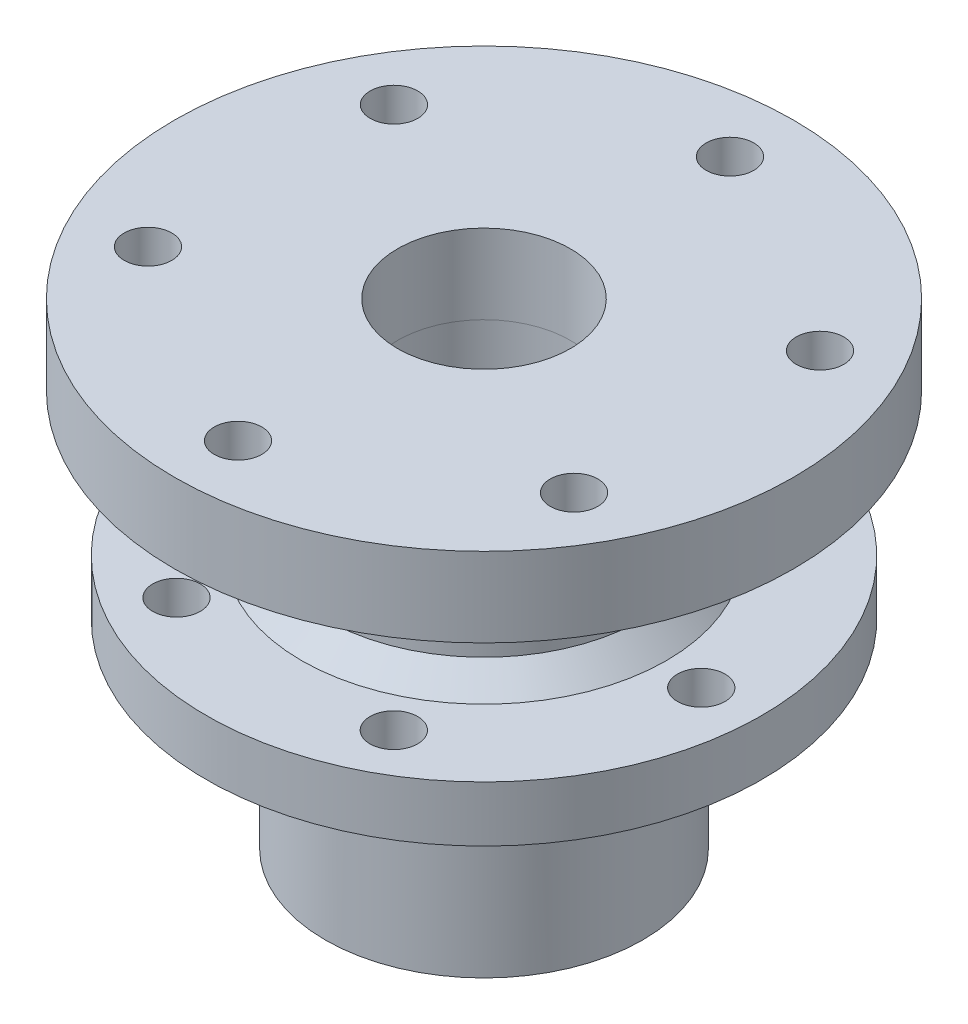
from build123d import *

# Parameters (mm, degrees)
EXTRUDE_START       = -10
SKETCH_1_R          = 20
SKETCH_1_R_2        = 11
EXTRUDE_1_DEPTH     = 50
SKETCH_2_R          = 39
SKETCH_2_R_2        = 10.9
EXTRUDE_2_DEPTH     = 10
CHAMFER_1_SIZE      = 4
SKETCH_3_R          = 35
SKETCH_3_R_2        = 17
EXTRUDE_3_DEPTH     = 7
CHAMFER_2_SIZE      = 3
SKETCH_4_R          = 3.000000009
CUT_EXTRUDE_1_DEPTH = 64.765194268
CUT_EXTRUDE_4_REACH = 83.498
SKETCH_5_R          = 3


with BuildPart() as part:
    # Эскиз1 → Вытянуть1 (new body)
    with BuildSketch(Plane(origin=(0, 0, 0), x_dir=(1, 0, 0), z_dir=(0, 1, 0)).offset(EXTRUDE_START)):
        with Locations(Location((0, 0, 0), (0, 0, 270))):
            Circle(SKETCH_1_R)
        with Locations(Location((0, 0, 0), (0, 0, 270))):
            Circle(SKETCH_1_R_2, mode=Mode.SUBTRACT)
    extrude(amount=EXTRUDE_1_DEPTH)

    # Эскиз2 → Вытянуть2 (add)
    with BuildSketch(Plane(origin=(0, 40, 0), x_dir=(1, 0, 0), z_dir=(0, 1, 0))):
        with Locations(Location((0, 0, 0), (0, 0, 270))):
            Circle(SKETCH_2_R)
        with Locations(Location((0, 0, 0), (0, 0, 270))):
            Circle(SKETCH_2_R_2, mode=Mode.SUBTRACT)
    extrude(amount=EXTRUDE_2_DEPTH)

    # Фаска1
    chamfer_1_edges = [part.edges().sort_by_distance(p)[0] for p in [
        (0, 40, -20),
    ]]
    chamfer(chamfer_1_edges, length=CHAMFER_1_SIZE)

    # Эскиз3 → Вытянуть3 (add)
    with BuildSketch(Plane.XZ.offset(-15)):
        with Locations(Location((0, 0, 0), (0, 0, 270))):
            Circle(SKETCH_3_R)
        Circle(SKETCH_3_R_2, mode=Mode.SUBTRACT)
    extrude(amount=-EXTRUDE_3_DEPTH)

    # Фаска2
    chamfer_2_edges = [part.edges().sort_by_distance(p)[0] for p in [
        (0, 22, -20),
    ]]
    chamfer(chamfer_2_edges, length=CHAMFER_2_SIZE)

    # Эскиз4 → Вырез-Вытянуть1 (cut, through all)
    with BuildSketch(Plane(origin=(0, 22, 0), x_dir=(1, 0, 0), z_dir=(0, 1, 0))):
        with Locations(Location((-13.413764566, 24.758384407, 0), (0, 0, 270))):
            Circle(SKETCH_4_R)
        with Locations(Location((14.742626006, 23.99086611, 0), (0, 0, 270))):
            Circle(SKETCH_4_R)
        with Locations(Location((28.156130949, -0.777042552, 0), (0, 0, 270))):
            Circle(SKETCH_4_R)
        with Locations(Location((13.41324532, -24.777432917, 0), (0, 0, 270))):
            Circle(SKETCH_4_R)
        with Locations(Location((-14.743145251, -24.009914621, 0), (0, 0, 270))):
            Circle(SKETCH_4_R)
        with Locations(Location((-28.156650194, 0.757994041, 0), (0, 0, 270))):
            Circle(SKETCH_4_R)
    extrude(amount=-CUT_EXTRUDE_1_DEPTH, mode=Mode.SUBTRACT)

    # Эскиз5 → Вытянуть4 (cut, up to next)
    with BuildSketch(Plane(origin=(0, 50, 0), x_dir=(1, 0, 0), z_dir=(0, 1, 0)), mode=Mode.PRIVATE) as cut_extrude_4_sk1:
        with Locations(Location((0, 31, 0), (0, 0, 270))):
            Circle(SKETCH_5_R)
    cut_extrude_4_tool1 = extrude(cut_extrude_4_sk1.sketch, amount=-CUT_EXTRUDE_4_REACH, mode=Mode.PRIVATE) & part.part
    # Эскиз5 → Вытянуть4 (cut, up to next)
    with BuildSketch(Plane(origin=(0, 50, 0), x_dir=(1, 0, 0), z_dir=(0, 1, 0)), mode=Mode.PRIVATE) as cut_extrude_4_sk2:
        with Locations(Location((26.846787517, 15.5, 0), (0, 0, 270))):
            Circle(SKETCH_5_R)
    cut_extrude_4_tool2 = extrude(cut_extrude_4_sk2.sketch, amount=-CUT_EXTRUDE_4_REACH, mode=Mode.PRIVATE) & part.part
    # Эскиз5 → Вытянуть4 (cut, up to next)
    with BuildSketch(Plane(origin=(0, 50, 0), x_dir=(1, 0, 0), z_dir=(0, 1, 0)), mode=Mode.PRIVATE) as cut_extrude_4_sk3:
        with Locations(Location((26.846787517, -15.5, 0), (0, 0, 270))):
            Circle(SKETCH_5_R)
    cut_extrude_4_tool3 = extrude(cut_extrude_4_sk3.sketch, amount=-CUT_EXTRUDE_4_REACH, mode=Mode.PRIVATE) & part.part
    # Эскиз5 → Вытянуть4 (cut, up to next)
    with BuildSketch(Plane(origin=(0, 50, 0), x_dir=(1, 0, 0), z_dir=(0, 1, 0)), mode=Mode.PRIVATE) as cut_extrude_4_sk4:
        with Locations(Location((0, -31, 0), (0, 0, 270))):
            Circle(SKETCH_5_R)
    cut_extrude_4_tool4 = extrude(cut_extrude_4_sk4.sketch, amount=-CUT_EXTRUDE_4_REACH, mode=Mode.PRIVATE) & part.part
    # Эскиз5 → Вытянуть4 (cut, up to next)
    with BuildSketch(Plane(origin=(0, 50, 0), x_dir=(1, 0, 0), z_dir=(0, 1, 0)), mode=Mode.PRIVATE) as cut_extrude_4_sk5:
        with Locations(Location((-26.846787517, -15.5, 0), (0, 0, 270))):
            Circle(SKETCH_5_R)
    cut_extrude_4_tool5 = extrude(cut_extrude_4_sk5.sketch, amount=-CUT_EXTRUDE_4_REACH, mode=Mode.PRIVATE) & part.part
    # Эскиз5 → Вытянуть4 (cut, up to next)
    with BuildSketch(Plane(origin=(0, 50, 0), x_dir=(1, 0, 0), z_dir=(0, 1, 0)), mode=Mode.PRIVATE) as cut_extrude_4_sk6:
        with Locations(Location((-26.846787517, 15.5, 0), (0, 0, 270))):
            Circle(SKETCH_5_R)
    cut_extrude_4_tool6 = extrude(cut_extrude_4_sk6.sketch, amount=-CUT_EXTRUDE_4_REACH, mode=Mode.PRIVATE) & part.part
    add(cut_extrude_4_tool1.solids().sort_by_distance((0, 50, -31))[0], mode=Mode.SUBTRACT)
    add(cut_extrude_4_tool2.solids().sort_by_distance((26.846788, 50, -15.5))[0], mode=Mode.SUBTRACT)
    add(cut_extrude_4_tool3.solids().sort_by_distance((26.846788, 50, 15.5))[0], mode=Mode.SUBTRACT)
    add(cut_extrude_4_tool4.solids().sort_by_distance((0, 50, 31))[0], mode=Mode.SUBTRACT)
    add(cut_extrude_4_tool5.solids().sort_by_distance((-26.846788, 50, 15.5))[0], mode=Mode.SUBTRACT)
    add(cut_extrude_4_tool6.solids().sort_by_distance((-26.846788, 50, -15.5))[0], mode=Mode.SUBTRACT)


solid = part.part
